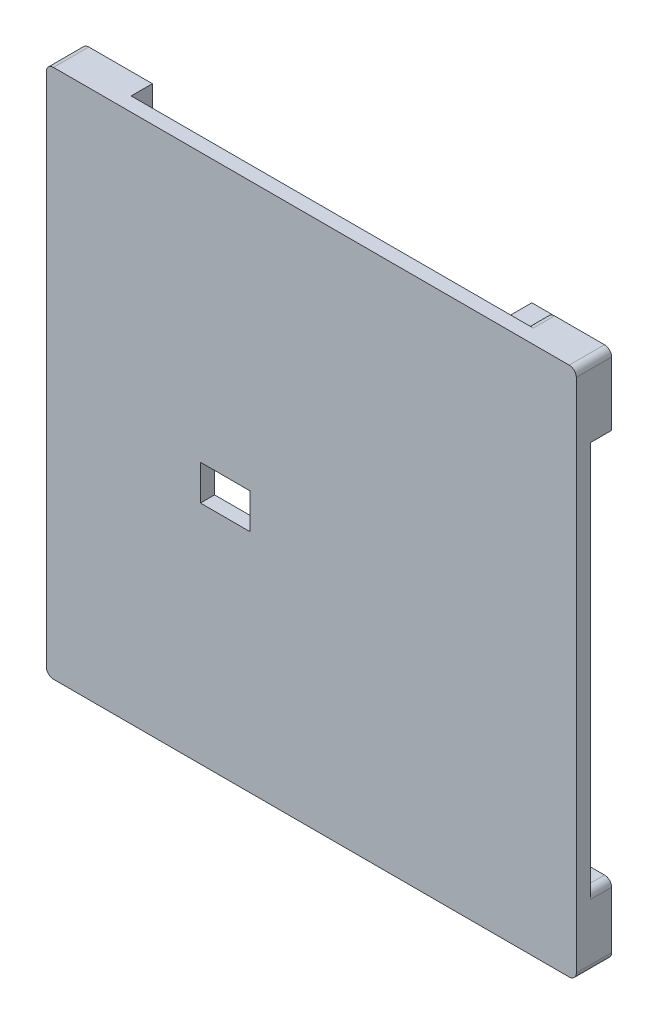
from build123d import *

# Parameters (mm, degrees)
RESSALTO_EXTRUS_O1_DEPTH   = 3
RESSALTO_EXTRUS_O1_2_DEPTH = 3
RESSALTO_EXTRUS_O1_3_DEPTH = 3
RESSALTO_EXTRUS_O1_4_DEPTH = 3
RESSALTO_EXTRUS_O2_DEPTH   = 2
ESBO_O13_W                 = 0.999795876
ESBO_O13_H                 = 5.679795897
RESSALTO_EXTRUS_O3_DEPTH   = 3
CORTE_EXTRUS_O4_DEPTH      = 3
ESBO_O22_W                 = 3
ESBO_O22_H                 = 2.1
ESBO_O22_H_2               = 8
RESSALTO_EXTRUS_O5_DEPTH   = 4
ESBO_O15_W                 = 3.5
ESBO_O15_H                 = 3.5
CORTE_EXTRUS_O1_DEPTH      = 3.5
ESBO_O16_W                 = 8
ESBO_O16_H                 = 8
CORTE_EXTRUS_O2_DEPTH      = 1
ESBO_O18_W                 = 7
ESBO_O18_H                 = 5
CORTE_EXTRUS_O3_DEPTH      = 10


with BuildPart() as part:
    # Esboço1 → Ressalto-extrusão1 (new body)
    with BuildSketch(Plane.XY):
        with BuildLine():
            Line((10, -36.5), (10, -31.8))
            ThreePointArc((10, -31.8), (9.707106781, -31.092893219), (9, -30.8))
            Line((9, -30.8), (8.409000397, -30.8))
            Line((8.409000397, -30.8), (8.409000397, -27.5))
            Line((8.409000397, -27.5), (0, -27.5))
            Line((0, -27.5), (0, -36.5))
            ThreePointArc((0, -36.5), (0.292893219, -37.207106781), (1, -37.5))
            Line((1, -37.5), (9, -37.5))
            ThreePointArc((9, -37.5), (9.707106781, -37.207106781), (10, -36.5))
        make_face()
    extrude(amount=RESSALTO_EXTRUS_O1_DEPTH)



with BuildPart() as body_2:
    # Esboço1 → Ressalto-extrus_o1 2 (new body)
    with BuildSketch(Plane.XY):
        with BuildLine():
            Line((75, -36.5), (75, -28.5))
            ThreePointArc((75, -28.5), (74.707106781, -27.792893219), (74, -27.5))
            Line((74, -27.5), (66.909000397, -27.5))
            ThreePointArc((66.909000397, -27.5), (66.201893616, -27.792893219), (65.909000397, -28.5))
            Line((65.909000397, -28.5), (65.909000397, -36.5))
            ThreePointArc((65.909000397, -36.5), (66.201893616, -37.207106781), (66.909000397, -37.5))
            Line((66.909000397, -37.5), (74, -37.5))
            ThreePointArc((74, -37.5), (74.707106781, -37.207106781), (75, -36.5))
        make_face()
    extrude(amount=RESSALTO_EXTRUS_O1_2_DEPTH)


with BuildPart() as body_3:
    # Esboço1 → Ressalto-extrus_o1 3 (new body)
    with BuildSketch(Plane.XY):
        with BuildLine():
            Line((65.909000397, 36.5), (65.909000397, 28.5))
            ThreePointArc((65.909000397, 28.5), (66.201893616, 27.792893219), (66.909000397, 27.5))
            Line((66.909000397, 27.5), (75, 27.5))
            Line((75, 27.5), (75, 36.5))
            ThreePointArc((75, 36.5), (74.707106781, 37.207106781), (74, 37.5))
            Line((74, 37.5), (66.909000397, 37.5))
            ThreePointArc((66.909000397, 37.5), (66.201893616, 37.207106781), (65.909000397, 36.5))
        make_face()
    extrude(amount=RESSALTO_EXTRUS_O1_3_DEPTH)


with BuildPart() as body_4:
    # Esboço1 → Ressalto-extrus_o1 4 (new body)
    with BuildSketch(Plane.XY):
        with BuildLine():
            Line((9, 37.5), (1, 37.5))
            ThreePointArc((1, 37.5), (0.292893219, 37.207106781), (0, 36.5))
            Line((0, 36.5), (0, 28.5))
            ThreePointArc((0, 28.5), (0.292893219, 27.792893219), (1, 27.5))
            Line((1, 27.5), (7.409000397, 27.5))
            ThreePointArc((7.409000397, 27.5), (8.116107178, 27.792893219), (8.409000397, 28.5))
            Line((8.409000397, 28.5), (8.409000397, 30.8))
            Line((8.409000397, 30.8), (9, 30.8))
            ThreePointArc((9, 30.8), (9.71421429, 31.100072898), (9.999795876, 31.820204103))
            Line((9.999795876, 31.820204103), (9, 31.820204103))
            Line((9, 31.820204103), (9, 37.5))
        make_face()
    extrude(amount=RESSALTO_EXTRUS_O1_4_DEPTH)


with BuildPart() as part_1:
    add(part.part)

    add(body_2.part)  # Ressalto-extrusão2 merges body 2

    add(body_3.part)  # Ressalto-extrusão2 merges body 3

    add(body_4.part)  # Ressalto-extrusão2 merges body 4
    # Esboço2 → Ressalto-extrusão2 (add)
    with BuildSketch(Plane.XY.offset(3)):
        with BuildLine():
            Line((1, 37.5), (74, 37.5))
            ThreePointArc((74, 37.5), (74.707106781, 37.207106781), (75, 36.5))
            Line((75, 36.5), (75, -36.5))
            ThreePointArc((75, -36.5), (74.707106781, -37.207106781), (74, -37.5))
            Line((74, -37.5), (1, -37.5))
            ThreePointArc((1, -37.5), (0.292893219, -37.207106781), (0, -36.5))
            Line((0, -36.5), (0, 36.5))
            ThreePointArc((0, 36.5), (0.292893219, 37.207106781), (1, 37.5))
        make_face()
    extrude(amount=RESSALTO_EXTRUS_O2_DEPTH)

    # Esboço13 → Ressalto-extrusão3 (add)
    with BuildSketch(Plane(origin=(0, 0, 3), x_dir=(-1, 0, 0), z_dir=(0, 0, -1))):
        with Locations((-9.499897938, 34.660102052)):
            Rectangle(ESBO_O13_W, ESBO_O13_H)
    extrude(amount=RESSALTO_EXTRUS_O3_DEPTH)

    # Esboço20 → Corte-extrusão4 (cut)
    with BuildSketch(Plane(origin=(0, 0, 0), x_dir=(-1, 0, 0), z_dir=(0, 0, -1))):
        with BuildLine():
            Line((-8.409000397, 31.8), (-8.999795876, 31.8))
            ThreePointArc((-8.999795876, 31.8), (-9.706902657, 32.092893219), (-9.999795876, 32.8))
            Line((-9.999795876, 32.8), (-9.999795876, 30.8))
            Line((-9.999795876, 30.8), (-8.409000397, 30.8))
            Line((-8.409000397, 30.8), (-8.409000397, 31.8))
        make_face()
        with BuildLine():
            Line((-8.409000397, -30.8), (-8.409000397, -31.8))
            Line((-8.409000397, -31.8), (-9, -31.8))
            ThreePointArc((-9, -31.8), (-9.707106781, -32.092893219), (-10, -32.8))
            Line((-10, -32.8), (-10, -30.8))
            Line((-10, -30.8), (-8.409000397, -30.8))
        make_face()
    extrude(amount=-CORTE_EXTRUS_O4_DEPTH, mode=Mode.SUBTRACT)

    # Esboço22 → Ressalto-extrusão5 (add)
    with BuildSketch(Plane(origin=(0, 0, 3), x_dir=(-1, 0, 0), z_dir=(0, 0, -1))):
        with Locations((-10.109000397, 30.55)):
            Rectangle(ESBO_O22_W, ESBO_O22_H)
        with Locations((-10.109000397, -30.55)):
            Rectangle(ESBO_O22_W, ESBO_O22_H)
        with Locations((-64.209000397, 32.5)):
            Rectangle(ESBO_O22_W, ESBO_O22_H_2)
        with Locations((-64.209000397, -32.5)):
            Rectangle(ESBO_O22_W, ESBO_O22_H_2)
    extrude(amount=RESSALTO_EXTRUS_O5_DEPTH)

    # Esboço15 → Corte-extrusão1 (cut)
    with BuildSketch(Plane(origin=(0, 0, 0), x_dir=(-1, 0, 0), z_dir=(0, 0, -1))):
        with Locations((-4.25, -32.5)):
            Rectangle(ESBO_O15_W, ESBO_O15_H)
        with Locations((-4.25, 32.5)):
            Rectangle(ESBO_O15_W, ESBO_O15_H)
        with Locations((-70.459000397, 32.5)):
            Rectangle(ESBO_O15_W, ESBO_O15_H)
        with Locations((-70.459000397, -32.5)):
            Rectangle(ESBO_O15_W, ESBO_O15_H)
    extrude(amount=-CORTE_EXTRUS_O1_DEPTH, mode=Mode.SUBTRACT)

    # Esboço16 → Corte-extrusão2 (cut)
    with BuildSketch(Plane(origin=(0, 0, 3), x_dir=(-1, 0, 0), z_dir=(0, 0, -1))):
        with Locations((-25.263712601, 2.900523079)):
            Rectangle(ESBO_O16_W, ESBO_O16_H)
    extrude(amount=-CORTE_EXTRUS_O2_DEPTH, mode=Mode.SUBTRACT)

    # Esboço18 → Corte-extrusão3 (cut)
    with BuildSketch(Plane(origin=(0, 0, 3), x_dir=(-1, 0, 0), z_dir=(0, 0, -1))):
        with Locations((-25.3, -3)):
            Rectangle(ESBO_O18_W, ESBO_O18_H)
    extrude(amount=-CORTE_EXTRUS_O3_DEPTH, mode=Mode.SUBTRACT)


solid = part_1.part
